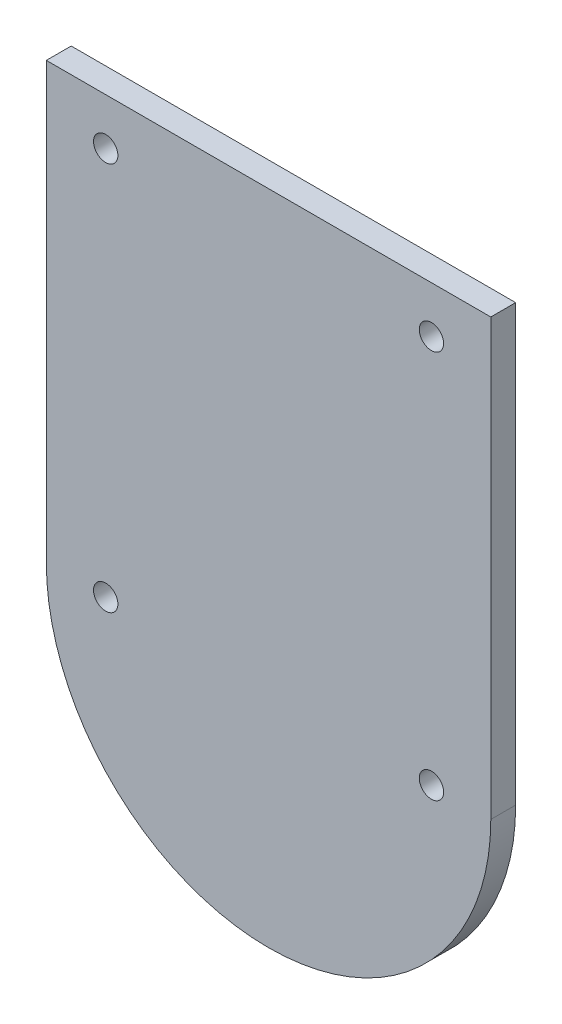
from build123d import *

# Parameters (mm, degrees)
MODEL_R             = 0.7834936
MODEL_R_2           = 6.5
MODEL_W             = 10.5
MODEL_H             = 3
MODEL_H_2           = 4
MODEL_R_3           = 1.229367
EXTRUDE_8_DEPTH     = 1.6
CUT_EXTRUDE_1_DEPTH = 10


with BuildPart() as part:
    # Model → 凸台-拉伸8 (new body)
    # profile 1 of 6: a face of its own
    with BuildSketch(Plane.XY):
        with BuildLine():
            Line((-28.162112801, 27.669809042), (-37.212112801, 27.669809042))
            Line((-37.212112801, 27.669809042), (-37.212112801, -0.330212606))
            ThreePointArc((-37.212112801, -0.330212606), (-22.912101977, -14.630201782), (-8.612112801, -0.330190958))
            Line((-8.612112801, -0.330190958), (-8.612112801, 27.669809042))
            Line((-8.612112801, 27.669809042), (-17.662112801, 27.669809042))
            Line((-17.662112801, 27.669809042), (-17.662112801, 24.669809042))
            Line((-17.662112801, 24.669809042), (-16.932112801, 24.669809042))
            ThreePointArc((-16.932112801, 24.669809042), (-15.87145263, 24.230469214), (-15.432112801, 23.169809042))
            Line((-15.432112801, 23.169809042), (-15.432112801, -0.330190958))
            ThreePointArc((-15.432112801, -0.330190958), (-22.912112801, -7.810190958), (-30.392112801, -0.330190958))
            Line((-30.392112801, -0.330190958), (-30.392112801, 23.169809042))
            ThreePointArc((-30.392112801, 23.169809042), (-29.952772973, 24.230469214), (-28.892112801, 24.669809042))
            Line((-28.892112801, 24.669809042), (-28.162112801, 24.669809042))
            Line((-28.162112801, 24.669809042), (-28.162112801, 27.669809042))
        make_face()
        with Locations((-33.392112801, -0.330190958)):
            Circle(MODEL_R, mode=Mode.SUBTRACT)
        with Locations((-12.432112801, -0.330190958)):
            Circle(MODEL_R, mode=Mode.SUBTRACT)
        with Locations((-33.392112801, 24.669809042)):
            Circle(MODEL_R, mode=Mode.SUBTRACT)
        with Locations((-12.432112801, 24.669809042)):
            Circle(MODEL_R, mode=Mode.SUBTRACT)
    # profile 2 of 6: a face of its own
    with BuildSketch(Plane.XY):
        with BuildLine():
            Line((-30.392112801, -0.330190958), (-30.392112801, 23.169809042))
            ThreePointArc((-30.392112801, 23.169809042), (-29.952772973, 24.230469214), (-28.892112801, 24.669809042))
            Line((-28.892112801, 24.669809042), (-16.932112801, 24.669809042))
            ThreePointArc((-16.932112801, 24.669809042), (-15.87145263, 24.230469214), (-15.432112801, 23.169809042))
            Line((-15.432112801, 23.169809042), (-15.432112801, -0.330190958))
            ThreePointArc((-15.432112801, -0.330190958), (-22.912112801, -7.810190958), (-30.392112801, -0.330190958))
        make_face()
        with Locations((-22.912112801, -0.330190958)):
            Circle(MODEL_R_2, mode=Mode.SUBTRACT)
    # profile 3 of 6: a face of its own
    with BuildSketch(Plane.XY):
        with Locations((-22.912112801, 26.169809042)):
            Rectangle(MODEL_W, MODEL_H)
    # profile 4 of 6: a face of its own
    with BuildSketch(Plane.XY):
        with Locations((-22.912112801, 29.669809042)):
            Rectangle(MODEL_W, MODEL_H_2)
        with Locations((-22.912112801, 29.669809042)):
            Circle(MODEL_R_3, mode=Mode.SUBTRACT)
    # profile 5 of 6: a face of its own
    with BuildSketch(Plane.XY):
        with Locations((-22.912112801, 29.669809042)):
            Circle(MODEL_R_3)
    # profile 6 of 6: a face of its own
    with BuildSketch(Plane.XY):
        with Locations((-22.912112801, -0.330190958)):
            Circle(MODEL_R_2)
    extrude(amount=EXTRUDE_8_DEPTH)

    # 草图1 → 切除-拉伸1 (cut)
    with BuildSketch(Plane.XY.offset(1.6)):
        Polygon((-28.162112801, 27.669809042), (-17.662112801, 27.669809042), (-17.662112801, 34.986019155), (-28.743542957, 34.986019155), align=None)
    extrude(amount=-CUT_EXTRUDE_1_DEPTH, mode=Mode.SUBTRACT)


solid = part.part
